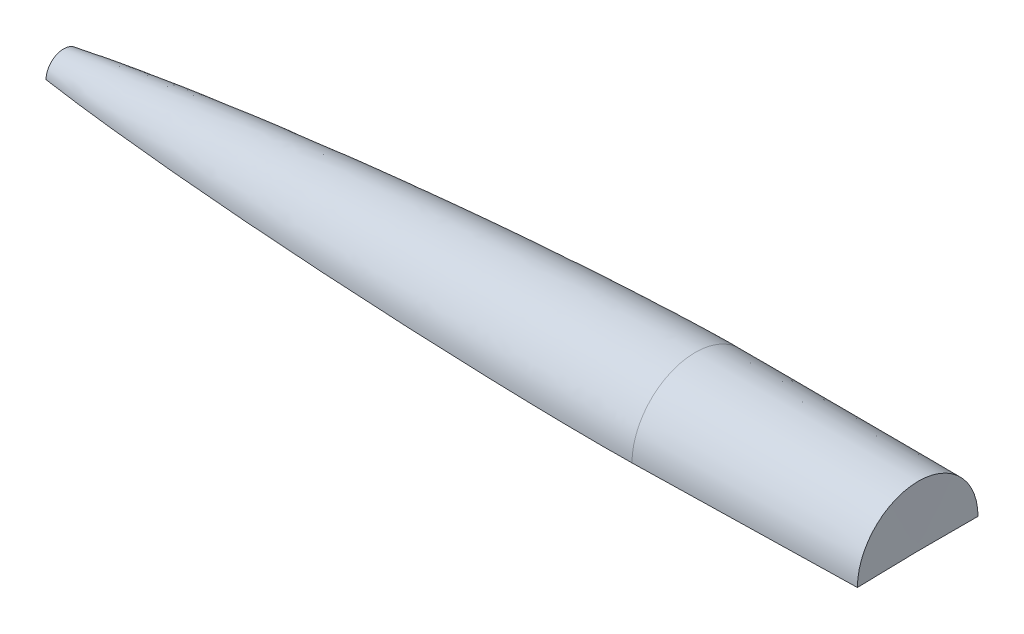
from build123d import *

# Parameters (mm, degrees)
MAIN_BODY_ANGLE    = 180
SKETCH4_R          = 7.488886282
CUT_EXTRUDE3_DEPTH = 314.706


with BuildPart() as part:
    # Sketch1 → main body (revolve)
    with BuildSketch(Plane(origin=(0, 0, 0), x_dir=(1, 0, 0), z_dir=(0, 1, 0))):
        with BuildLine():
            Line((851.304580924, 76.199999981), (1122.351487721, 76.199999981))
            Line((1122.351487721, 76.199999981), (1122.351487721, 1.314116237))
            Line((1122.351487721, 1.314116237), (88.767646843, -9.90077432))
            Line((88.767646843, -9.90077432), (85.047844716, 11.755993253))
            add(Edge.make_bspline(
                [(85.047844716, 11.755993253), (85.832587091, 11.890781898), (87.402836258, 12.159136758), (90.416610596, 12.670807369), (93.537061612, 13.191295846), (97.170324673, 13.792715976), (100.505753233, 14.336151071), (104.017067052, 14.903266848), (107.43124622, 15.44744047), (111.760486229, 16.130713414), (116.925319179, 16.933892159), (122.97234892, 17.858691385), (129.875476741, 18.893918943), (138.513733131, 20.165711278), (148.881759566, 21.656330843), (160.986205499, 23.34879505), (174.826871573, 25.224656034), (192.137141027, 27.502956481), (212.92194706, 30.13846819), (237.187067416, 33.084521174), (264.937120957, 36.294322773), (292.703329319, 39.361555726), (320.48370577, 42.297239812), (348.276817571, 45.109883275), (376.081450756, 47.806042159), (403.896666786, 50.390753056), (431.721669201, 52.867795697), (459.55581535, 55.239882083), (487.398559468, 57.508784018), (515.249450888, 59.675386165), (543.108107682, 61.739743915), (577.940738985, 64.191336351), (612.785340127, 66.468237191), (647.641366116, 68.563465621), (689.481889181, 70.843491315), (724.359891248, 72.534917854), (759.248611408, 73.99264986), (792.5650977, 75.109399967), (814.624980969, 75.693818945), (832.405478938, 76.037890758), (843.204698036, 76.166034998), (848.604594276, 76.201321913), (851.304580924, 76.199999981)],
                knots=[0.087900162, 0.087900162, 0.087900162, 0.087900162, 0.087900162, 0.092039082, 0.096178001, 0.100316921, 0.10445584, 0.10859476, 0.112733679, 0.116872599, 0.121011519, 0.129289358, 0.137567197, 0.145845036, 0.154122875, 0.170678553, 0.18723423, 0.203789907, 0.220345585, 0.253456939, 0.286568294, 0.319679649, 0.352791005, 0.38590236, 0.419013716, 0.45212507, 0.485236425, 0.518347781, 0.551459136, 0.584570491, 0.617681846, 0.650793202, 0.683904557, 0.750127267, 0.783238623, 0.816349978, 0.882572688, 0.915684044, 0.948795399, 0.974397699, 0.98719885, 1, 1, 1, 1, 1], degree=4))
        make_face()
    revolve(axis=Axis((1122.351487721, 0, -1.314116237), (0.9999411386367943, 0, -0.01084985077091772)), revolution_arc=MAIN_BODY_ANGLE)

    # Sketch4 → Cut-Extrude3 (cut)
    with BuildSketch(Plane(origin=(0, 0, 0), x_dir=(0, 0, -1), z_dir=(1, 0, 0))):
        with Locations((-9.90077432, 0)):
            Circle(SKETCH4_R)
    extrude(amount=CUT_EXTRUDE3_DEPTH, mode=Mode.SUBTRACT)


solid = part.part
